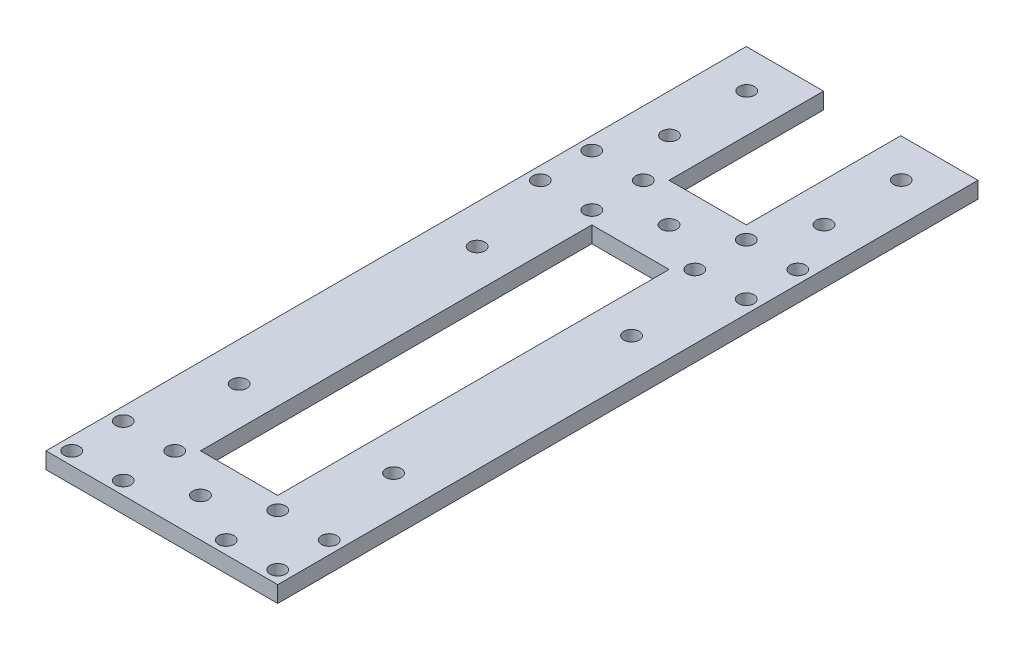
from build123d import *

# Parameters (mm, degrees)
BOSS_EXTRUDE1_DEPTH = 3.175
SKETCH2_R           = 1.5
CUT_EXTRUDE1_DEPTH  = 154.964138984
SKETCH4_R           = 1.5
CUT_EXTRUDE2_DEPTH  = 154.964138984
SKETCH5_W           = 15
SKETCH5_H           = 30
SKETCH5_R           = 1.5
BOSS_EXTRUDE2_DEPTH = 3.175
SKETCH6_R           = 1.5
CUT_EXTRUDE3_DEPTH  = 159.599807878


with BuildPart() as part:
    # Sketch1 → Boss-Extrude1 (new body)
    with BuildSketch(Plane(origin=(0, 0, 0), x_dir=(1, 0, 0), z_dir=(0, 1, 0))):
        Polygon((110.595057034, -9.673003802), (95.595057034, -9.673003802), (95.595057034, -62.673003802), (118.095057034, -62.673003802), (118.095057034, -47.673003802), (110.595057034, -47.673003802), align=None)
        Polygon((95.595057034, 43.326996198), (95.595057034, -9.673003802), (110.595057034, -9.673003802), (110.595057034, 28.326996198), (118.095057034, 28.326996198), (118.095057034, 43.326996198), align=None)
        Polygon((140.595057034, 43.326996198), (118.095057034, 43.326996198), (118.095057034, 28.326996198), (125.595057034, 28.326996198), (125.595057034, -9.673003802), (140.595057034, -9.673003802), align=None)
        Polygon((118.095057034, -47.673003802), (118.095057034, -62.673003802), (140.595057034, -62.673003802), (140.595057034, -9.673003802), (125.595057034, -9.673003802), (125.595057034, -47.673003802), align=None)
    extrude(amount=BOSS_EXTRUDE1_DEPTH)

    # Sketch2 → Cut-Extrude1 (cut, through all)
    with BuildSketch(Plane.XZ):
        with Locations(Location((128.095812091, -40.826241141, 0), (0, 0, 270))):
            Circle(SKETCH2_R)
        with Locations(Location((138.094301977, -40.826241141, 0), (0, 0, 270))):
            Circle(SKETCH2_R)
        with Locations(Location((138.094301977, -30.827751255, 0), (0, 0, 270))):
            Circle(SKETCH2_R)
        with Locations(Location((128.095812091, -30.827751255, 0), (0, 0, 270))):
            Circle(SKETCH2_R)
        with Locations(Location((138.094301977, 60.172248745, 0), (0, 0, 90))):
            Circle(SKETCH2_R)
        with Locations(Location((138.094301977, 50.173758859, 0), (0, 0, 90))):
            Circle(SKETCH2_R)
        with Locations(Location((128.095812091, 50.173758859, 0), (0, 0, 90))):
            Circle(SKETCH2_R)
        with Locations(Location((128.095812091, 60.172248745, 0), (0, 0, 90))):
            Circle(SKETCH2_R)
        with Locations(Location((98.095812091, -40.826241141, 0), (0, 0, 90))):
            Circle(SKETCH2_R)
        with Locations(Location((98.095812091, -30.827751255, 0), (0, 0, 90))):
            Circle(SKETCH2_R)
        with Locations(Location((108.094301977, -30.827751255, 0), (0, 0, 90))):
            Circle(SKETCH2_R)
        with Locations(Location((108.094301977, -40.826241141, 0), (0, 0, 90))):
            Circle(SKETCH2_R)
        with Locations(Location((98.095812091, 50.173758859, 0), (0, 0, 270))):
            Circle(SKETCH2_R)
        with Locations(Location((98.095812091, 60.172248745, 0), (0, 0, 270))):
            Circle(SKETCH2_R)
        with Locations(Location((108.094301977, 60.172248745, 0), (0, 0, 270))):
            Circle(SKETCH2_R)
        with Locations(Location((108.094301977, 50.173758859, 0), (0, 0, 270))):
            Circle(SKETCH2_R)
    extrude(amount=-CUT_EXTRUDE1_DEPTH, mode=Mode.SUBTRACT)

    # Sketch4 → Cut-Extrude2 (cut, through all)
    with BuildSketch(Plane.XZ):
        with Locations(Location((133.095057034, 32.673003802, 0), (0, 0, 270))):
            Circle(SKETCH4_R)
        with Locations(Location((133.095057034, -13.549475249, 0), (0, 0, 270))):
            Circle(SKETCH4_R)
        with Locations(Location((103.095057034, -13.549475249, 0), (0, 0, 90))):
            Circle(SKETCH4_R)
        with Locations(Location((103.095057034, 32.673003802, 0), (0, 0, 90))):
            Circle(SKETCH4_R)
    extrude(amount=-CUT_EXTRUDE2_DEPTH, mode=Mode.SUBTRACT)

    # Sketch5 → Boss-Extrude2 (add)
    # profile 1 of 2: a face of its own
    with BuildSketch(Plane.XZ):
        with Locations((133.095057034, -58.326996198)):
            Rectangle(SKETCH5_W, SKETCH5_H)
        Polygon((133.095057034, -58.326996198), (133.117194018, -58.371270165), (133.095057034, -58.415806265), align=None, mode=Mode.SUBTRACT)
        with Locations(Location((133.095057034, -50.915806265, 0), (0, 0, 270))):
            Circle(SKETCH5_R, mode=Mode.SUBTRACT)
        with Locations(Location((133.095057034, -65.915806265, 0), (0, 0, 270))):
            Circle(SKETCH5_R, mode=Mode.SUBTRACT)
    # profile 2 of 2: a face of its own
    with BuildSketch(Plane.XZ):
        with Locations((103.095057034, -58.326996198)):
            Rectangle(SKETCH5_W, SKETCH5_H)
        with Locations(Location((103.095057034, -65.915806265, 0), (0, 0, 270))):
            Circle(SKETCH5_R, mode=Mode.SUBTRACT)
        with Locations(Location((103.095057034, -50.915806265, 0), (0, 0, 270))):
            Circle(SKETCH5_R, mode=Mode.SUBTRACT)
    extrude(amount=-BOSS_EXTRUDE2_DEPTH)

    # Sketch6 → Cut-Extrude3 (cut, through all)
    with BuildSketch(Plane(origin=(0, 3.175, 0), x_dir=(1, 0, 0), z_dir=(0, 1, 0))):
        with Locations(Location((118.095057034, -55.173003802, 0), (0, 0, 270))):
            Circle(SKETCH6_R)
        with Locations(Location((118.095057034, 35.826996198, 0), (0, 0, 90))):
            Circle(SKETCH6_R)
    extrude(amount=-CUT_EXTRUDE3_DEPTH, mode=Mode.SUBTRACT)


solid = part.part
